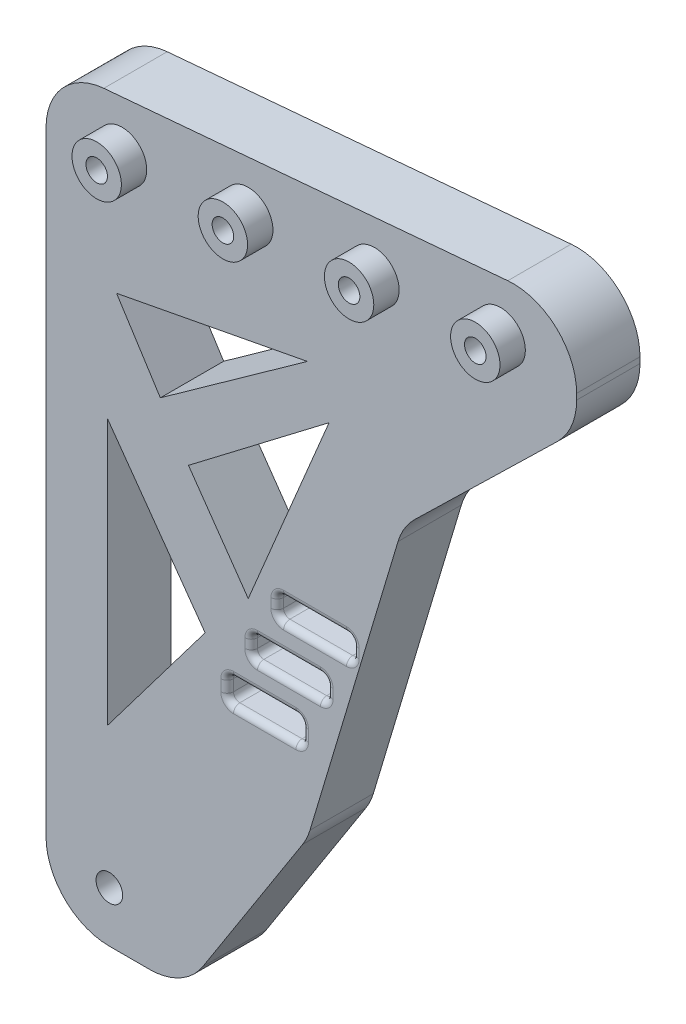
from build123d import *

# Parameters (mm, degrees)
SKETCH_1_R      = 2.1
SKETCH_1_W      = 11.841859062
SKETCH_1_H      = 3.79198791
SKETCH_1_W_2    = 11.932177887
SKETCH_1_H_2    = 3.457618633
SKETCH_1_W_3    = 11.932177888
SKETCH_1_R_2    = 3.9
EXTRUDE_1_DEPTH = 10
FILLET_1_R      = 10
SKETCH_2_R      = 3.9
SKETCH_2_R_2    = 1.7
EXTRUDE_2_DEPTH = 14
FILLET_2_R      = 1


with BuildPart() as part:
    # 草圖1 → 填料-伸長1 (new body)
    # profile 1 of 2: a face of its own
    with BuildSketch(Plane.XY):
        Polygon((71.771681886, -1.751350173), (-12, -9.080422663), (-12, -109.080422663), (9.806246547, -109.080422663), (29.269879348, -78.727071705), (44.31368037, -28.486453197), align=None)
        with Locations((-2, -101.080422663)):
            Circle(SKETCH_1_R, mode=Mode.SUBTRACT)
        Polygon((-2.299936438, -79.053873156), (-2.299936438, -37.088159429), (13.117147072, -58.672076343), align=None, mode=Mode.SUBTRACT)
        with Locations((22.516562227, -64.601939977)):
            Rectangle(SKETCH_1_W, SKETCH_1_H, mode=Mode.SUBTRACT)
        with Locations((26.352420456, -56.943267027)):
            Rectangle(SKETCH_1_W_2, SKETCH_1_H_2, mode=Mode.SUBTRACT)
        with Locations((30.468759199, -49.38774458)):
            Rectangle(SKETCH_1_W_3, SKETCH_1_H_2, mode=Mode.SUBTRACT)
        Polygon((19.923893962, -50.59008221), (10.491457035, -37.088159429), (32.688459439, -20.161691414), align=None, mode=Mode.SUBTRACT)
        Polygon((6.048232781, -30.080374262), (-0.862476164, -19.243324952), (29.269879348, -13.493483856), align=None, mode=Mode.SUBTRACT)
    # profile 2 of 2: a face of its own
    with BuildSketch(Plane.XY):
        Polygon((71.771681886, 14.309767228), (71.771681886, -1.751350173), (-12, -9.080422663), (-12, 6.980694738), align=None)
        with Locations((59.771681886, 5.229344565)):
            Circle(SKETCH_1_R_2, mode=Mode.SUBTRACT)
        with Locations((39.847787924, 3.48622971)):
            Circle(SKETCH_1_R_2, mode=Mode.SUBTRACT)
        with Locations((19.923893962, 1.743114855)):
            Circle(SKETCH_1_R_2, mode=Mode.SUBTRACT)
        Circle(SKETCH_1_R_2, mode=Mode.SUBTRACT)
    extrude(amount=EXTRUDE_1_DEPTH)

    # 圓角1
    fillet_1_edges = [part.edges().sort_by_distance(p)[0] for p in [
        (29.269879348, -78.727071705, 5),
        (9.806246547, -109.080422663, 5),
        (-12, -109.080422663, 5),
        (-12, 6.980694738, 5),
        (71.771681886, 14.309767228, 5),
        (71.771681886, -1.751350173, 5),
        (44.31368037, -28.486453197, 5),
    ]]
    fillet(fillet_1_edges, radius=FILLET_1_R)

    # 草圖2 → 填料-伸長2 (add)
    # profile 1 of 4: a face of its own
    with BuildSketch(Plane.XY):
        Circle(SKETCH_2_R)
        Circle(SKETCH_2_R_2, mode=Mode.SUBTRACT)
    # profile 2 of 4: a face of its own
    with BuildSketch(Plane.XY):
        with Locations((19.923893962, 1.743114855)):
            Circle(SKETCH_2_R)
        with Locations((19.923893962, 1.743114855)):
            Circle(SKETCH_2_R_2, mode=Mode.SUBTRACT)
    # profile 3 of 4: a face of its own
    with BuildSketch(Plane.XY):
        with Locations((39.847787924, 3.48622971)):
            Circle(SKETCH_2_R)
        with Locations((39.847787924, 3.48622971)):
            Circle(SKETCH_2_R_2, mode=Mode.SUBTRACT)
    # profile 4 of 4: a face of its own
    with BuildSketch(Plane.XY):
        with Locations((59.771681886, 5.229344565)):
            Circle(SKETCH_2_R)
        with Locations((59.771681886, 5.229344565)):
            Circle(SKETCH_2_R_2, mode=Mode.SUBTRACT)
    extrude(amount=EXTRUDE_2_DEPTH)

    # 圓角2
    fillet_2_edges = [part.edges().sort_by_distance(p)[0] for p in [
        (22.516562227, -66.497933932, 10),
        (16.595632696, -64.601939977, 10),
        (22.516562227, -62.705946022, 10),
        (28.437491758, -64.601939977, 10),
        (24.502670255, -49.387744579, 10),
        (30.468759199, -47.658935263, 10),
        (36.434848143, -49.387744579, 10),
        (30.468759199, -51.116553896, 10),
        (20.386331512, -56.943267027, 10),
        (28.437491758, -64.601939977, 0),
        (22.516562227, -62.705946022, 0),
        (16.595632696, -64.601939977, 0),
        (22.516562227, -66.497933932, 0),
        (26.352420456, -55.21445771, 10),
        (32.318509399, -56.943267027, 10),
        (26.352420456, -58.672076343, 0),
        (32.318509399, -56.943267027, 0),
        (26.352420456, -55.21445771, 0),
        (20.386331512, -56.943267027, 0),
        (30.468759199, -51.116553896, 0),
        (36.434848143, -49.387744579, 0),
        (30.468759199, -47.658935263, 0),
        (24.502670255, -49.387744579, 0),
        (26.352420456, -58.672076343, 10),
        (28.437491758, -66.497933932, 5),
        (28.437491758, -62.705946022, 5),
        (16.595632696, -62.705946022, 5),
        (16.595632696, -66.497933932, 5),
        (20.386331512, -58.672076343, 5),
        (32.318509399, -58.672076343, 5),
        (32.318509399, -55.21445771, 5),
        (20.386331512, -55.21445771, 5),
        (24.502670255, -51.116553896, 5),
        (36.434848143, -51.116553896, 5),
        (36.434848143, -47.658935263, 5),
        (24.502670255, -47.658935263, 5),
    ]]
    fillet(fillet_2_edges, radius=FILLET_2_R)


solid = part.part
